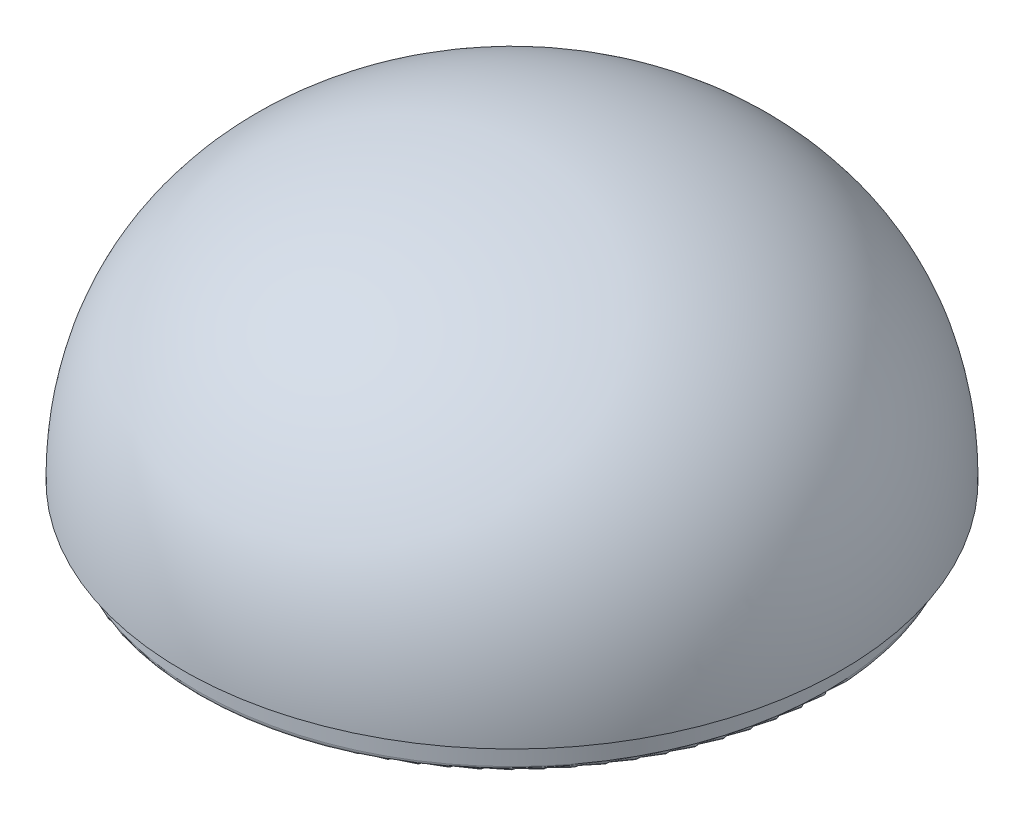
from build123d import *

# Parameters (mm, degrees)
FILLET1_R = 0.5


with BuildPart() as part:
    # Sketch2 → Revolve1 (revolve)
    with BuildSketch(Plane.XY, mode=Mode.PRIVATE) as revolve1_sk:
        with BuildLine():
            Line((-29.7, 0), (-28.7, 0))
            Line((-28.7, 0), (-28.7, 3))
            Line((-28.7, 3), (-29.7, 4))
            Line((-29.7, 4), (-30.184026904, 4))
            add(Edge.make_bspline(
                [(-30.184026904, 4), (-30.166623492, 4.54069605), (-30.101486192, 5.634791729), (-29.85987076, 7.705122509), (-29.354955902, 10.152548026), (-28.451009727, 12.848310996), (-26.880303632, 16.14102408), (-24.288807456, 19.707939202), (-20.346681081, 23.158657086), (-15.748479669, 25.805349854), (-10.689451806, 27.666671311), (-5.353447893, 28.762877066), (-1.787836999, 29), (0, 29)],
                knots=[0.018366947, 0.018366947, 0.018366947, 0.018366947, 0.04904298, 0.079719013, 0.141071079, 0.202423145, 0.263775211, 0.386479342, 0.509183474, 0.631887605, 0.754591737, 0.877295868, 1, 1, 1, 1], degree=3))
            Line((0, 29), (0, 30))
            add(Edge.make_bspline(
                [(-31.2, 3), (-31.2, 21.931598134), (-14.795104957, 30), (0, 30)],
                knots=[0, 0, 0, 0, 1, 1, 1, 1], degree=3))
            Line((-31.2, 3), (-29.7, 3))
            Line((-29.7, 3), (-29.7, 0))
        make_face()
    revolve(revolve1_sk.sketch.rotate(Axis((0, 0, 0), (0, 1, 0)), 270), axis=Axis((0, 0, 0), (0, 1, 0)))

    # Fillet1
    fillet1_edges = [part.edges().sort_by_distance(p)[0] for p in [
        (0, 0, 29.7),
    ]]
    fillet(fillet1_edges, radius=FILLET1_R)


solid = part.part
